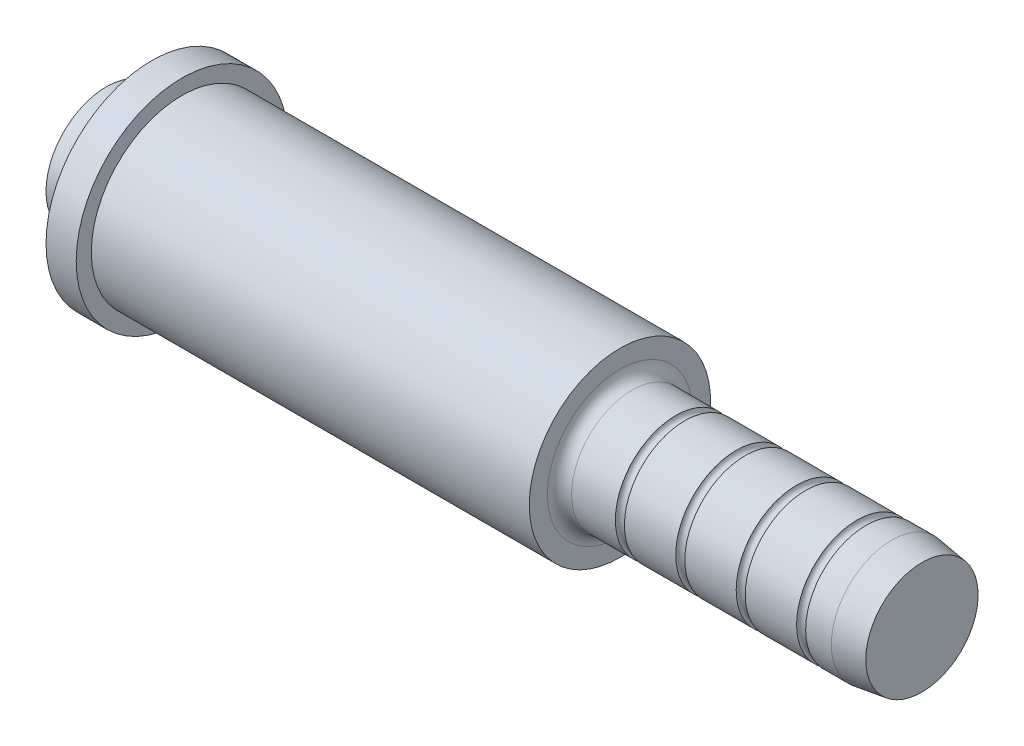
from build123d import *

# Parameters (mm, degrees)
FILLET1_R      = 4
CHAMFER1_SIZE  = 10
CHAMFER1_SIZE2 = 1.405408347
SKETCH2_R      = 1.5


with BuildPart() as part:
    # Sketch1 → Revolve1 (revolve)
    with BuildSketch(Plane.XY, mode=Mode.PRIVATE) as revolve1_sk:
        Polygon((0, 0), (270, 0), (270, 20), (170, 20), (170, 30), (25, 30), (25, 35), (15, 35), (15, 20), (0, 20), align=None)
    revolve(revolve1_sk.sketch.rotate(Axis((0, 0, 0), (1, 0, 0)), 90), axis=Axis((0, 0, 0), (1, 0, 0)))

    # Fillet1
    fillet1_edges = [part.edges().sort_by_distance(p)[0] for p in [
        (170, 0, -20),
    ]]
    fillet(fillet1_edges, radius=FILLET1_R)

    # Chamfer1
    chamfer1_edges = [part.edges().sort_by_distance(p)[0] for p in [
        (270, 0, -20),
    ]]
    chamfer1_side = [part.faces().sort_by_distance(p)[0] for p in [
        (222, 0, -20),
    ]]
    chamfer(chamfer1_edges, length=CHAMFER1_SIZE, length2=CHAMFER1_SIZE2, reference=chamfer1_side[0])

    # Sketch2 → Cut-Revolve1 (revolve, cut)
    with BuildSketch(Plane.XY, mode=Mode.PRIVATE) as cut_revolve1_sk:
        with Locations((190, 20)):
            Circle(SKETCH2_R)
        with Locations((210, 20)):
            Circle(SKETCH2_R)
        with Locations((230, 20)):
            Circle(SKETCH2_R)
        with Locations((250, 20)):
            Circle(SKETCH2_R)
    revolve(cut_revolve1_sk.sketch.rotate(Axis((170, 0, 0), (-1, 0, 0)), 270), axis=Axis((170, 0, 0), (-1, 0, 0)), mode=Mode.SUBTRACT)


solid = part.part
